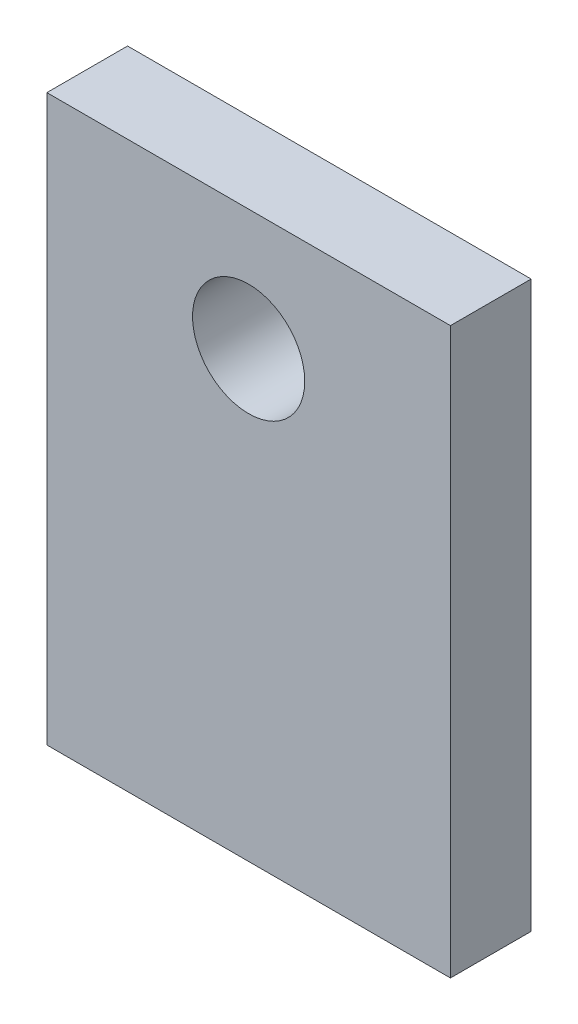
from build123d import *

# Parameters (mm, degrees)
SKETCH1_W          = 127
SKETCH1_H          = 177.8
SKETCH1_R          = 17.653
BASE_EXTRUDE_DEPTH = 25.4


with BuildPart() as part:
    # Sketch1 → Base-Extrude (new body)
    with BuildSketch(Plane.XY):
        with Locations((63.5, 88.9)):
            Rectangle(SKETCH1_W, SKETCH1_H)
        with Locations((63.5, 139.7)):
            Circle(SKETCH1_R, mode=Mode.SUBTRACT)
    extrude(amount=BASE_EXTRUDE_DEPTH)


solid = part.part
